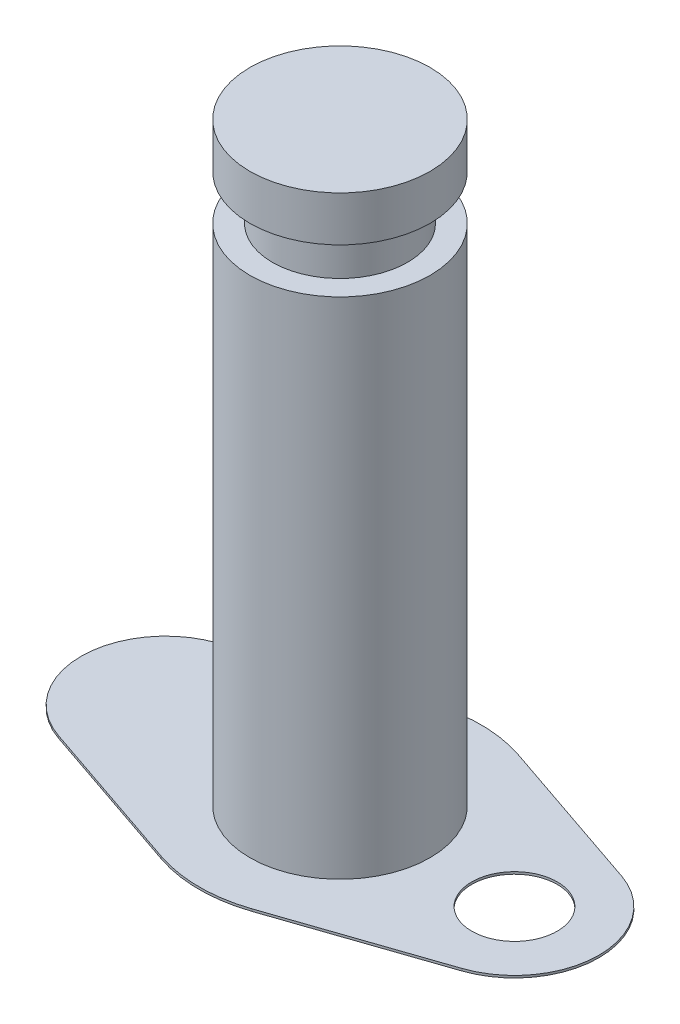
from build123d import *

# Parameters (mm, degrees)
SKETCH1_R                      = 6.25
SKETCH1_R_2                    = 3.75
SKETCH1_R_3                    = 2.5
BOSS_EXTRUDE1_DEPTH            = 0.1
SKETCH2_R                      = 4
BOSS_EXTRUDE2_DEPTH            = 22.5
SKETCH3_R                      = 3
BOSS_EXTRUDE3_DEPTH            = 2
SKETCH4_R                      = 4
BOSS_EXTRUDE4_DEPTH            = 2
SKETCH6_W                      = 1.89865
SKETCH6_H                      = 0.1
F_6_CLEARANCE_HOLE1_AT_2_COUNT = 2
F_6_CLEARANCE_HOLE1_AT_2_PITCH = 7.75
F_6_32_TAPPED_HOLE2_D          = 2.7051
F_6_32_TAPPED_HOLE2_DEPTH      = 9.39
F_6_32_TAPPED_HOLE2_TIP        = 0.81269403


with BuildPart() as part:
    # Sketch1 → Boss-Extrude1 (new body)
    # profile 1 of 15: a face of its own
    with BuildSketch(Plane(origin=(0, 0, 0), x_dir=(1, 0, 0), z_dir=(0, 1, 0))):
        Circle(SKETCH1_R)
    # profile 2 of 15: a face of its own
    with BuildSketch(Plane(origin=(0, 0, 0), x_dir=(1, 0, 0), z_dir=(0, 1, 0))):
        with Locations((-7.75, 0)):
            Circle(SKETCH1_R_2)
        with Locations((-7.75, 0)):
            Circle(SKETCH1_R_3, mode=Mode.SUBTRACT)
    # profile 3 of 15: a face of its own
    with BuildSketch(Plane(origin=(0, 0, 0), x_dir=(1, 0, 0), z_dir=(0, 1, 0))):
        Circle(SKETCH1_R)
    # profile 4 of 15: a face of its own
    with BuildSketch(Plane(origin=(0, 0, 0), x_dir=(1, 0, 0), z_dir=(0, 1, 0))):
        with Locations((-7.75, 0)):
            Circle(SKETCH1_R_2)
        with Locations((-7.75, 0)):
            Circle(SKETCH1_R_3, mode=Mode.SUBTRACT)
    # profile 5 of 15: a face of its own
    with BuildSketch(Plane(origin=(0, 0, 0), x_dir=(1, 0, 0), z_dir=(0, 1, 0))):
        with Locations((7.75, 0)):
            Circle(SKETCH1_R_2)
    # profile 6 of 15: a face of its own
    with BuildSketch(Plane(origin=(0, 0, 0), x_dir=(1, 0, 0), z_dir=(0, 1, 0))):
        Circle(SKETCH1_R)
    # profile 7 of 15: a face of its own
    with BuildSketch(Plane(origin=(0, 0, 0), x_dir=(1, 0, 0), z_dir=(0, 1, 0))):
        with Locations((-7.75, 0)):
            Circle(SKETCH1_R_2)
    # profile 8 of 15: a face of its own
    with BuildSketch(Plane(origin=(0, 0, 0), x_dir=(1, 0, 0), z_dir=(0, 1, 0))):
        with BuildLine():
            ThreePointArc((-5.487903226, -2.990889196), (-7.15425073, -3.702375293), (-8.959677419, -3.54953244))
            Line((-8.959677419, -3.54953244), (-2.016129032, -5.9158874))
            ThreePointArc((-2.016129032, -5.9158874), (-4.026975125, -4.77974595), (-5.487903226, -2.990889196))
        make_face()
    # profile 9 of 15: a face of its own
    with BuildSketch(Plane(origin=(0, 0, 0), x_dir=(1, 0, 0), z_dir=(0, 1, 0))):
        with BuildLine():
            ThreePointArc((5.487903226, -2.990889196), (4.026975125, -4.77974595), (2.016129032, -5.9158874))
            Line((2.016129032, -5.9158874), (8.959677419, -3.54953244))
            ThreePointArc((8.959677419, -3.54953244), (7.15425073, -3.702375293), (5.487903226, -2.990889196))
        make_face()
    # profile 10 of 15: a face of its own
    with BuildSketch(Plane(origin=(0, 0, 0), x_dir=(1, 0, 0), z_dir=(0, 1, 0))):
        Circle(SKETCH1_R)
    # profile 11 of 15: a face of its own
    with BuildSketch(Plane(origin=(0, 0, 0), x_dir=(1, 0, 0), z_dir=(0, 1, 0))):
        with Locations((7.75, 0)):
            Circle(SKETCH1_R_2)
        with Locations((7.75, 0)):
            Circle(SKETCH1_R_3, mode=Mode.SUBTRACT)
    # profile 12 of 15: a face of its own
    with BuildSketch(Plane(origin=(0, 0, 0), x_dir=(1, 0, 0), z_dir=(0, 1, 0))):
        with Locations((7.75, 0)):
            Circle(SKETCH1_R_2)
        with Locations((7.75, 0)):
            Circle(SKETCH1_R_3, mode=Mode.SUBTRACT)
    # profile 13 of 15: a face of its own
    with BuildSketch(Plane(origin=(0, 0, 0), x_dir=(1, 0, 0), z_dir=(0, 1, 0))):
        Circle(SKETCH1_R)
    # profile 14 of 15: a face of its own
    with BuildSketch(Plane(origin=(0, 0, 0), x_dir=(1, 0, 0), z_dir=(0, 1, 0))):
        with BuildLine():
            Line((8.959677419, 3.54953244), (2.016129032, 5.9158874))
            ThreePointArc((2.016129032, 5.9158874), (4.026975125, 4.77974595), (5.487903226, 2.990889196))
            ThreePointArc((5.487903226, 2.990889196), (7.15425073, 3.702375293), (8.959677419, 3.54953244))
        make_face()
    # profile 15 of 15: a face of its own
    with BuildSketch(Plane(origin=(0, 0, 0), x_dir=(1, 0, 0), z_dir=(0, 1, 0))):
        with BuildLine():
            Line((-2.016129032, 5.9158874), (-8.959677419, 3.54953244))
            ThreePointArc((-8.959677419, 3.54953244), (-7.15425073, 3.702375293), (-5.487903226, 2.990889196))
            ThreePointArc((-5.487903226, 2.990889196), (-4.026975125, 4.77974595), (-2.016129032, 5.9158874))
        make_face()
    extrude(amount=BOSS_EXTRUDE1_DEPTH)

    # Sketch2 → Boss-Extrude2 (add)
    with BuildSketch(Plane(origin=(0, 0, 0), x_dir=(1, 0, 0), z_dir=(0, 1, 0))):
        with Locations(Location((0, 0, 0), (0, 0, 90))):
            Circle(SKETCH2_R)
    extrude(amount=BOSS_EXTRUDE2_DEPTH)

    # Sketch3 → Boss-Extrude3 (add)
    with BuildSketch(Plane(origin=(0, 22.5, 0), x_dir=(1, 0, 0), z_dir=(0, 1, 0))):
        with Locations(Location((0, 0, 0), (0, 0, 270))):
            Circle(SKETCH3_R)
    extrude(amount=BOSS_EXTRUDE3_DEPTH)

    # Sketch4 → Boss-Extrude4 (add)
    with BuildSketch(Plane(origin=(0, 24.5, 0), x_dir=(1, 0, 0), z_dir=(0, 1, 0))):
        with Locations(Location((0, 0, 0), (0, 0, 90))):
            Circle(SKETCH4_R)
    extrude(amount=BOSS_EXTRUDE4_DEPTH)

    # Sketch6 → #6 Clearance Hole1 (revolve, cut)
    with BuildSketch(Plane(origin=(7.75, 0.1, 0), x_dir=(0, 0, 1), z_dir=(1, 0, 0))):
        with Locations((0.949325, 0.05)):
            Rectangle(SKETCH6_W, SKETCH6_H)
    f_6_clearance_hole1 = revolve(axis=Axis((7.75, 6.45, 0), (0, -1, 0)), mode=Mode.SUBTRACT)

    # #6 Clearance Hole1 at 2: #6 Clearance Hole1 ×2
    with Locations(*[(-i * F_6_CLEARANCE_HOLE1_AT_2_PITCH, 0, 0) for i in range(1, F_6_CLEARANCE_HOLE1_AT_2_COUNT)]):
        add(f_6_clearance_hole1, mode=Mode.SUBTRACT)

    # #6-32 Tapped Hole2
    with Locations(Plane(origin=(0, 0.1, 0), x_dir=(-1, 0, 0), z_dir=(0, -1, 0))):
        with Locations((0, 0)):
            Hole(F_6_32_TAPPED_HOLE2_D / 2, depth=F_6_32_TAPPED_HOLE2_DEPTH)
            with Locations((0, 0, -(F_6_32_TAPPED_HOLE2_DEPTH + F_6_32_TAPPED_HOLE2_TIP / 2))):  # 118° drill point
                Cone(0, F_6_32_TAPPED_HOLE2_D / 2, F_6_32_TAPPED_HOLE2_TIP, mode=Mode.SUBTRACT)


solid = part.part
